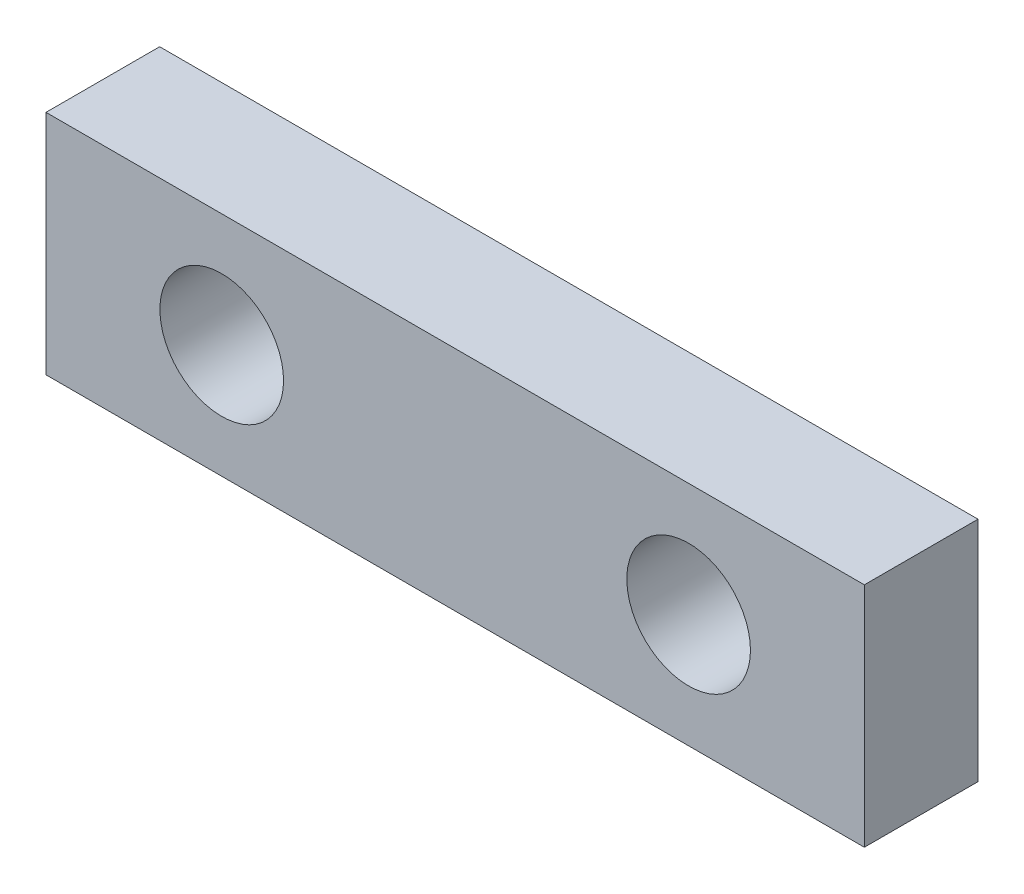
from build123d import *

# Parameters (mm, degrees)
SKETCH1_W             = 22.86
SKETCH1_H             = 6.35
BOSS_EXTRUDE1_DEPTH   = 3.175
F_4_CLEARANCE_HOLE1_D = 3.4544


with BuildPart() as part:
    # Sketch1 → Boss-Extrude1 (new body)
    with BuildSketch(Plane.XY):
        Rectangle(SKETCH1_W, SKETCH1_H)
    extrude(amount=BOSS_EXTRUDE1_DEPTH)

    # #4 Clearance Hole1 (through all)
    with Locations(Plane.XY.offset(3.175)):
        with Locations((-6.52145, 0), (6.52145, 0)):
            Hole(F_4_CLEARANCE_HOLE1_D / 2)


solid = part.part
